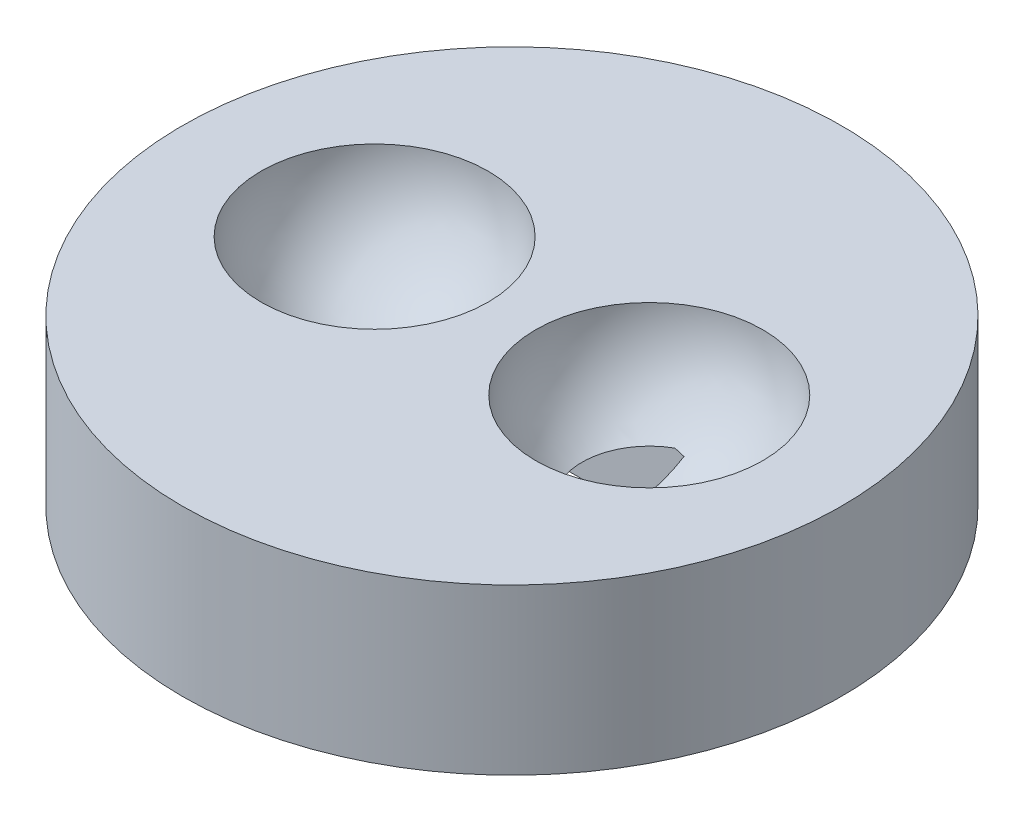
from build123d import *

# Parameters (mm, degrees)
SKETCH2_R           = 9
BOSS_EXTRUDE1_DEPTH = 4.5
SKETCH3_W           = 6.2
SKETCH3_H           = 3.2
CUT_EXTRUDE1_DEPTH  = 2


with BuildPart() as part:
    # Sketch2 → Boss-Extrude1 (new body)
    with BuildSketch(Plane(origin=(0, 0, 0), x_dir=(1, 0, 0), z_dir=(0, 1, 0))):
        Circle(SKETCH2_R)
    extrude(amount=BOSS_EXTRUDE1_DEPTH)

    # Sketch3 → Cut-Extrude1 (cut)
    with BuildSketch(Plane.XZ):
        Rectangle(SKETCH3_W, SKETCH3_H)
    extrude(amount=-CUT_EXTRUDE1_DEPTH, mode=Mode.SUBTRACT)

    # Sketch4 → Cut-Revolve1 (revolve, cut)
    with BuildSketch(Plane(origin=(0, 4.5, 0), x_dir=(1, 0, 0), z_dir=(0, 1, 0))):
        with BuildLine():
            Line((-3.75, 3.1), (-3.75, -3.1))
            ThreePointArc((-3.75, -3.1), (-6.85, 0), (-3.75, 3.1))
        make_face()
    cut_revolve1 = revolve(axis=Axis((-3.75, 4.5, -3.1), (0, 0, 1)), mode=Mode.SUBTRACT)

    # Mirror1: Cut-Revolve1 across plane
    add(cut_revolve1.mirror(Plane(origin=(0, 0, 0), x_dir=(0, 0, 1), z_dir=(1, 0, 0))), mode=Mode.SUBTRACT)


solid = part.part
